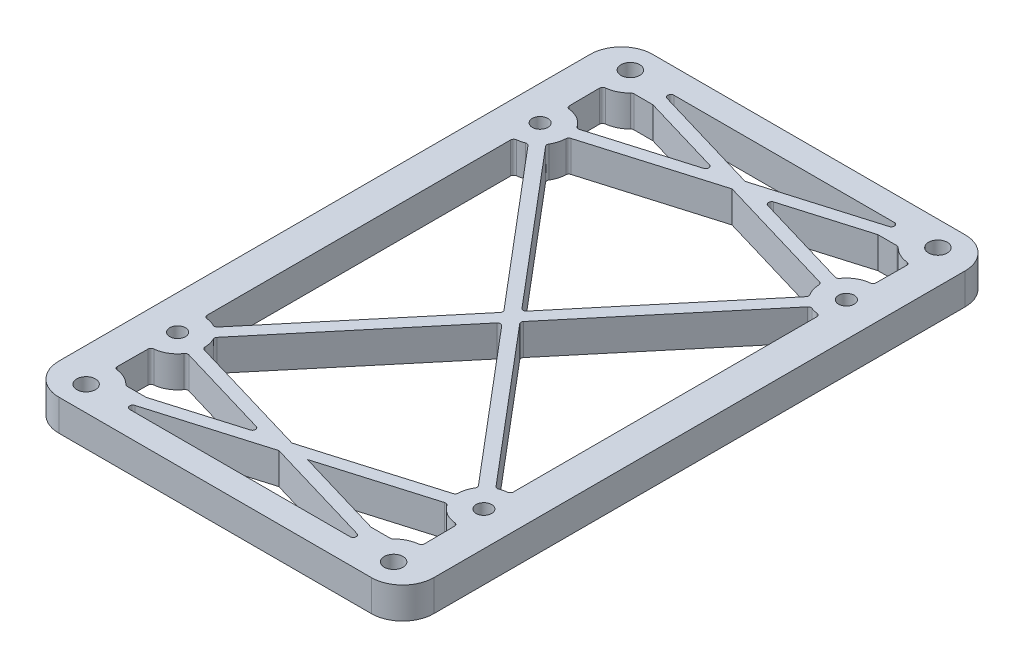
from build123d import *

# Parameters (mm, degrees)
SKETCH_1_W          = 60
SKETCH_1_H          = 95
EXTRUDE_1_DEPTH     = 5
SKETCH_2_R          = 1.5
SKETCH_2_R_2        = 1.25
CUT_EXTRUDE_1_DEPTH = 5
FILLET_1_R          = 5
CUT_EXTRUDE_4_DEPTH = 5
FILLET_4_R          = 0.5
FILLET_5_R          = 0.5


with BuildPart() as part:
    # 草图1 → 凸台-拉伸1 (new body)
    with BuildSketch(Plane(origin=(0, 0, 0), x_dir=(1, 0, 0), z_dir=(0, 1, 0))):
        Rectangle(SKETCH_1_W, SKETCH_1_H)
    extrude(amount=EXTRUDE_1_DEPTH)

    # 草图2 → 切除-拉伸1 (cut)
    with BuildSketch(Plane(origin=(0, 5, 0), x_dir=(1, 0, 0), z_dir=(0, 1, 0))):
        with Locations(Location((-24.605, 43.54, 0), (0, 0, 270))):
            Circle(SKETCH_2_R)
        with Locations(Location((24.605, 43.54, 0), (0, 0, 90))):
            Circle(SKETCH_2_R)
        with Locations(Location((24.605, -43.54, 0), (0, 0, 270))):
            Circle(SKETCH_2_R)
        with Locations(Location((-24.605, -43.54, 0), (0, 0, 90))):
            Circle(SKETCH_2_R)
        with Locations(Location((-24.5, 29, 0), (0, 0, 270))):
            Circle(SKETCH_2_R_2)
        with Locations(Location((24.5, 29, 0), (0, 0, 90))):
            Circle(SKETCH_2_R_2)
        with Locations(Location((24.5, -29, 0), (0, 0, 270))):
            Circle(SKETCH_2_R_2)
        with Locations(Location((-24.5, -29, 0), (0, 0, 90))):
            Circle(SKETCH_2_R_2)
    extrude(amount=-CUT_EXTRUDE_1_DEPTH, mode=Mode.SUBTRACT)

    # 圆角1
    fillet_1_edges = [part.edges().sort_by_distance(p)[0] for p in [
        (-30, 2.5, -47.5),
        (30, 2.5, -47.5),
        (30, 2.5, 47.5),
        (-30, 2.5, 47.5),
    ]]
    fillet(fillet_1_edges, radius=FILLET_1_R)

    # 草图3 → 切除-拉伸4 (cut)
    with BuildSketch(Plane.XZ):
        with BuildLine():
            Line((-24.572504286, 39.040117332), (-24.530690396, 33.249889187))
            ThreePointArc((-24.530690396, 33.249889187), (-22.391619047, 32.69015308), (-20.823217786, 31.131612664))
            Line((-20.823217786, 31.131612664), (-3.522175136, 36.25445474))
            Line((-3.522175136, 36.25445474), (-17.995469496, 40.54))
            Line((-17.995469496, 40.54), (-21.250898034, 40.54))
            ThreePointArc((-21.250898034, 40.54), (-22.753062375, 39.438740799), (-24.572504286, 39.040117332))
        make_face()
        with BuildLine():
            Line((-17.775077424, 42.560575343), (0, 37.297371479))
            Line((0, 37.297371479), (17.775077424, 42.560575343))
            ThreePointArc((17.775077424, 42.560575343), (18.12794912, 43.111720539), (17.63311969, 43.54))
            Line((17.63311969, 43.54), (-17.63311969, 43.54))
            ThreePointArc((-17.63311969, 43.54), (-18.12794912, 43.111720539), (-17.775077424, 42.560575343))
        make_face()
        with BuildLine():
            ThreePointArc((-22.264395713, 25.385505088), (-23.33791209, 24.911962367), (-24.5, 24.75))
            Line((-24.5, 24.75), (-24.5, -24.75))
            ThreePointArc((-24.5, -24.75), (-23.522899134, -24.863845518), (-22.598145824, -25.199282871))
            Line((-22.598145824, -25.199282871), (-1.176126043, 0.157393604))
            Line((-1.176126043, 0.157393604), (-22.264395713, 25.385505088))
        make_face()
        with BuildLine():
            Line((20.255386851, 29.213914036), (0, 35.211538001))
            Line((0, 35.211538001), (-20.255386851, 29.213914036))
            ThreePointArc((-20.255386851, 29.213914036), (-20.376517668, 27.970731589), (-20.853820398, 26.816453731))
            Line((-20.853820398, 26.816453731), (0.134149451, 1.708331943))
            Line((0.134149451, 1.708331943), (21.070374573, 26.48998617))
            ThreePointArc((21.070374573, 26.48998617), (20.428338154, 27.781775959), (20.255386851, 29.213914036))
        make_face()
        with BuildLine():
            Line((21.250898034, 40.54), (17.995469496, 40.54))
            Line((17.995469496, 40.54), (3.522175136, 36.25445474))
            Line((3.522175136, 36.25445474), (20.823217786, 31.131612664))
            ThreePointArc((20.823217786, 31.131612664), (22.391619047, 32.69015308), (24.530690396, 33.249889187))
            Line((24.530690396, 33.249889187), (24.572504286, 39.040117332))
            ThreePointArc((24.572504286, 39.040117332), (22.753062375, 39.438740799), (21.250898034, 40.54))
        make_face()
        with BuildLine():
            Line((-24.530690396, -33.249889187), (-24.572504286, -39.040117332))
            ThreePointArc((-24.572504286, -39.040117332), (-22.753062375, -39.438740799), (-21.250898034, -40.54))
            Line((-21.250898034, -40.54), (-17.995469496, -40.54))
            Line((-17.995469496, -40.54), (-3.522175136, -36.25445474))
            Line((-3.522175136, -36.25445474), (-20.823217786, -31.131612664))
            ThreePointArc((-20.823217786, -31.131612664), (-22.391619047, -32.69015308), (-24.530690396, -33.249889187))
        make_face()
        with BuildLine():
            Line((24.5, -24.75), (24.5, 24.75))
            ThreePointArc((24.5, 24.75), (23.522899134, 24.863845518), (22.598145824, 25.199282871))
            Line((22.598145824, 25.199282871), (1.436295206, 0.150561732))
            Line((1.436295206, 0.150561732), (22.618050588, -25.189387659))
            ThreePointArc((22.618050588, -25.189387659), (23.533719101, -24.861304405), (24.5, -24.75))
        make_face()
        with BuildLine():
            Line((0.126019713, -1.400376607), (-21.070374573, -26.48998617))
            ThreePointArc((-21.070374573, -26.48998617), (-20.428338154, -27.781775959), (-20.255386851, -29.213914036))
            Line((-20.255386851, -29.213914036), (0, -35.211538001))
            Line((0, -35.211538001), (20.255386851, -29.213914036))
            ThreePointArc((20.255386851, -29.213914036), (20.431537904, -27.771132157), (21.083549516, -26.472082658))
            Line((21.083549516, -26.472082658), (0.126019713, -1.400376607))
        make_face()
        with BuildLine():
            Line((17.775077424, -42.560575343), (0, -37.297371479))
            Line((0, -37.297371479), (-17.775077424, -42.560575343))
            ThreePointArc((-17.775077424, -42.560575343), (-18.12794912, -43.111720539), (-17.63311969, -43.54))
            Line((-17.63311969, -43.54), (17.63311969, -43.54))
            ThreePointArc((17.63311969, -43.54), (18.12794912, -43.111720539), (17.775077424, -42.560575343))
        make_face()
        with BuildLine():
            Line((3.522175136, -36.25445474), (17.995469496, -40.54))
            Line((17.995469496, -40.54), (21.250898034, -40.54))
            ThreePointArc((21.250898034, -40.54), (22.753062375, -39.438740799), (24.572504286, -39.040117332))
            Line((24.572504286, -39.040117332), (24.530690396, -33.249889187))
            ThreePointArc((24.530690396, -33.249889187), (22.391619047, -32.69015308), (20.823217786, -31.131612664))
            Line((20.823217786, -31.131612664), (3.522175136, -36.25445474))
        make_face()
    extrude(amount=-CUT_EXTRUDE_4_DEPTH, mode=Mode.SUBTRACT)

    # 圆角4
    fillet_4_edges = [part.edges().sort_by_distance(p)[0] for p in [
        (-20.823217786, 2.5, 31.131612664),
        (-24.530690396, 2.5, 33.249889187),
        (-24.572504286, 2.5, 39.040117332),
        (-21.250898034, 2.5, 40.54),
        (-3.522175136, 2.5, 36.25445474),
        (-21.250898034, 2.5, -40.54),
        (-24.572504286, 2.5, -39.040117332),
        (-24.530690396, 2.5, -33.249889187),
        (-20.823217786, 2.5, -31.131612664),
        (-3.522175136, 2.5, -36.25445474),
        (-20.853820398, 2.5, 26.816453731),
        (-20.255386851, 2.5, 29.213914036),
        (-20.255386851, 2.5, -29.213914036),
        (-21.070374573, 2.5, -26.48998617),
        (-22.264395713, 2.5, 25.385505088),
        (-1.176126043, 2.5, 0.157393604),
        (-22.598145824, 2.5, -25.199282871),
        (-24.5, 2.5, -24.75),
        (-24.5, 2.5, 24.75),
    ]]
    fillet(fillet_4_edges, radius=FILLET_4_R)

    # 圆角5
    fillet_5_edges = [part.edges().sort_by_distance(p)[0] for p in [
        (24.530690396, 2.5, 33.249889187),
        (20.823217786, 2.5, 31.131612664),
        (21.250898034, 2.5, 40.54),
        (24.572504286, 2.5, 39.040117332),
        (1.436295206, 2.5, 0.150561732),
        (22.598145824, 2.5, 25.199282871),
        (24.5, 2.5, 24.75),
        (24.5, 2.5, -24.75),
        (22.618050588, 2.5, -25.189387659),
        (20.255386851, 2.5, 29.213914036),
        (21.070374573, 2.5, 26.48998617),
        (0.134149451, 2.5, 1.708331943),
        (21.083549516, 2.5, -26.472082658),
        (20.255386851, 2.5, -29.213914036),
        (0.126019713, 2.5, -1.400376607),
        (24.572504286, 2.5, -39.040117332),
        (21.250898034, 2.5, -40.54),
        (3.522175136, 2.5, -36.25445474),
        (20.823217786, 2.5, -31.131612664),
        (24.530690396, 2.5, -33.249889187),
    ]]
    fillet(fillet_5_edges, radius=FILLET_5_R)


solid = part.part
